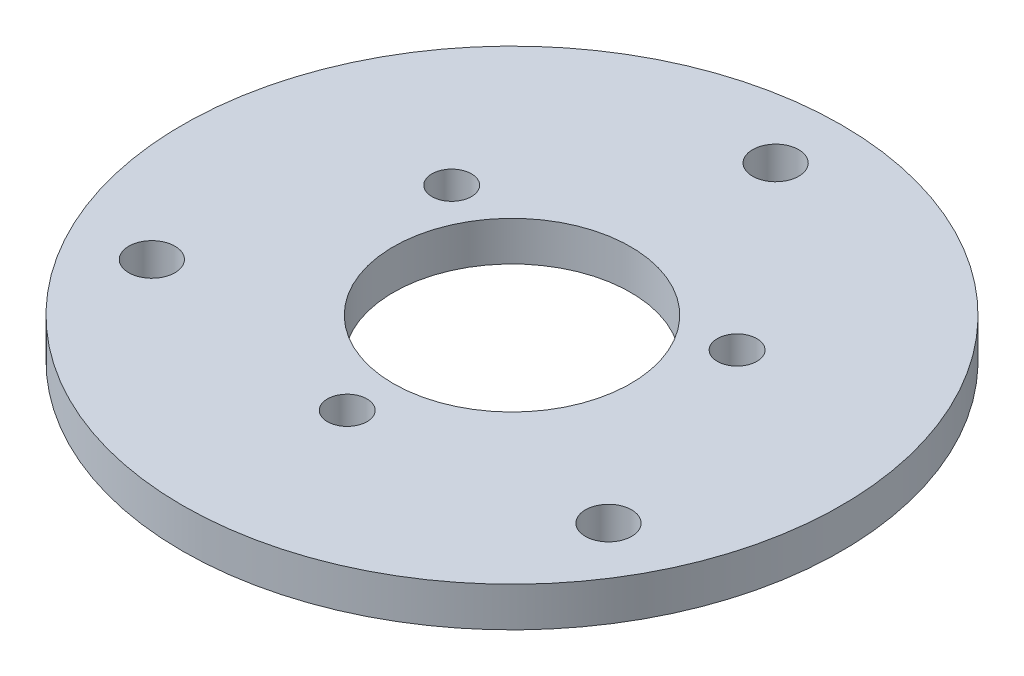
from build123d import *

# Parameters (mm, degrees)
SKETCH_1_R      = 25
EXTRUDE_1_DEPTH = 3
HOLE_WIZARD_1_D = 3.5
HOLE_WIZARD_2_D = 18
HOLE_WIZARD_3_D = 3


with BuildPart() as part:
    # 草图1 → 凸台-拉伸1 (new body)
    with BuildSketch(Plane(origin=(0, 0, 0), x_dir=(1, 0, 0), z_dir=(0, 1, 0))):
        with Locations(Location((0, 0, 0), (0, 0, 270))):
            Circle(SKETCH_1_R)
    extrude(amount=EXTRUDE_1_DEPTH)

    # 孔1 (through all)
    with Locations(Plane(origin=(0, 3, 0), x_dir=(1, 0, 0), z_dir=(0, 1, 0))):
        with Locations((0, 20), (-17.320508076, -10), (17.320508076, -10)):
            Hole(HOLE_WIZARD_1_D / 2)

    # 孔2 (through all)
    with Locations(Plane(origin=(0, 3, 0), x_dir=(1, 0, 0), z_dir=(0, 1, 0))):
        with Locations((0, 0)):
            Hole(HOLE_WIZARD_2_D / 2)

    # 孔3 (through all)
    with Locations(Plane(origin=(0, 3, 0), x_dir=(1, 0, 0), z_dir=(0, 1, 0))):
        with Locations((-10.825317547, 6.25), (0, -12.5), (10.825317547, 6.25)):
            Hole(HOLE_WIZARD_3_D / 2)


solid = part.part
